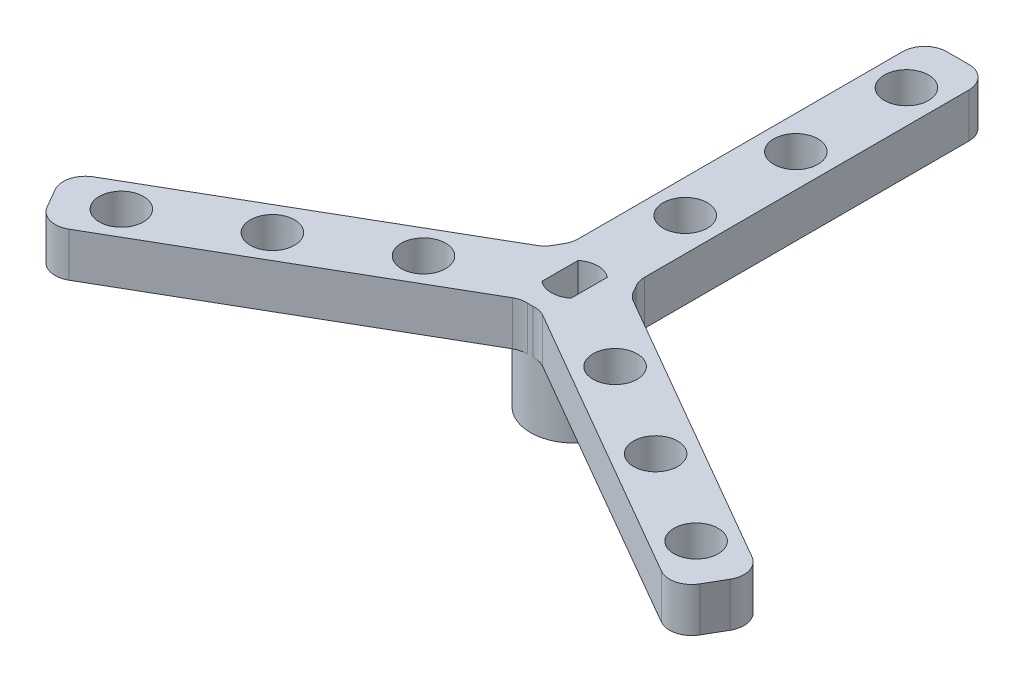
from build123d import *

# Parameters (mm, degrees)
SKETCH1_R           = 5
BOSS_EXTRUDE1_DEPTH = 12.5
SKETCH2_W           = 7.5
SKETCH2_H           = 40
BOSS_EXTRUDE4_DEPTH = 5
SKETCH4_R           = 2.5
CUT_EXTRUDE1_DEPTH  = 100
FILLET1_R           = 2.5
FILLET2_R           = 2.5


with BuildPart() as part:
    # Sketch1 → Boss-Extrude1 (new body)
    with BuildSketch(Plane(origin=(0, 0, 0), x_dir=(1, 0, 0), z_dir=(0, 1, 0))):
        with Locations(Location((0.037460471, 3.715413796, 0), (0, 0, 270))):
            Circle(SKETCH1_R)
        with BuildLine():
            ThreePointArc((-1.612539529, 1.667390359), (0.037460471, 1.085413796), (1.687460471, 1.667390359))
            Line((1.687460471, 1.667390359), (1.687460471, 5.76407365))
            ThreePointArc((1.687460471, 5.76407365), (0.037460471, 6.346050212), (-1.612539529, 5.76407365))
            Line((-1.612539529, 5.76407365), (-1.612539529, 1.667390359))
        make_face(mode=Mode.SUBTRACT)
    extrude(amount=BOSS_EXTRUDE1_DEPTH)

    # Sketch2 → Boss-Extrude4 (add)
    with BuildSketch(Plane(origin=(0, 12.5, 0), x_dir=(1, 0, 0), z_dir=(0, 1, 0))):
        Polygon((4.77657028, 5.309414491), (1.02657028, -1.185776038), (35.667586431, -21.185776038), (39.417586431, -14.690585509), align=None)
        with Locations((0.037460471, 27.022602935)):
            Rectangle(SKETCH2_W, SKETCH2_H)
        Polygon((-4.701649339, 5.309414491), (-0.951649339, -1.185776038), (-35.59266549, -21.185776038), (-39.34266549, -14.690585509), align=None)
    extrude(amount=-BOSS_EXTRUDE4_DEPTH)

    # Sketch4 → Cut-Extrude1 (cut)
    with BuildSketch(Plane(origin=(0, 12.5, 0), x_dir=(1, 0, 0), z_dir=(0, 1, 0))):
        with Locations(Location((0.037460471, 16.216050212, 0), (0, 0, 270))):
            Circle(SKETCH4_R)
        with Locations(Location((0.037460471, 28.716050212, 0), (0, 0, 270))):
            Circle(SKETCH4_R)
        with Locations(Location((0.037460471, 41.216050212, 0), (0, 0, 270))):
            Circle(SKETCH4_R)
        with Locations(Location((-10.788016154, -2.533674249, 0), (0, 0, 270))):
            Circle(SKETCH4_R)
        with Locations(Location((-21.613492779, -8.78339871, 0), (0, 0, 270))):
            Circle(SKETCH4_R)
        with Locations(Location((-32.438969404, -15.033123172, 0), (0, 0, 270))):
            Circle(SKETCH4_R)
        with Locations(Location((10.862937095, -2.533674249, 0), (0, 0, 90))):
            Circle(SKETCH4_R)
        with Locations(Location((21.68841372, -8.78339871, 0), (0, 0, 90))):
            Circle(SKETCH4_R)
        with Locations(Location((32.513890345, -15.033123172, 0), (0, 0, 90))):
            Circle(SKETCH4_R)
    extrude(amount=-CUT_EXTRUDE1_DEPTH, mode=Mode.SUBTRACT)

    # Fillet1
    fillet1_edges = [part.edges().sort_by_distance(p)[0] for p in [
        (4.77657028, 10, -5.309414491),
        (1.02657028, 10, 1.185776038),
        (-3.712539529, 10, -7.022602935),
        (3.787460471, 10, -7.022602935),
        (-4.701649339, 10, -5.309414491),
        (-0.951649339, 10, 1.185776038),
    ]]
    fillet(fillet1_edges, radius=FILLET1_R)

    # Fillet2
    fillet2_edges = [part.edges().sort_by_distance(p)[0] for p in [
        (39.417586431, 10, 14.690585509),
        (35.667586431, 10, 21.185776038),
        (-3.712539529, 10, -47.022602935),
        (3.787460471, 10, -47.022602935),
        (-39.34266549, 10, 14.690585509),
        (-35.59266549, 10, 21.185776038),
    ]]
    fillet(fillet2_edges, radius=FILLET2_R)


solid = part.part
